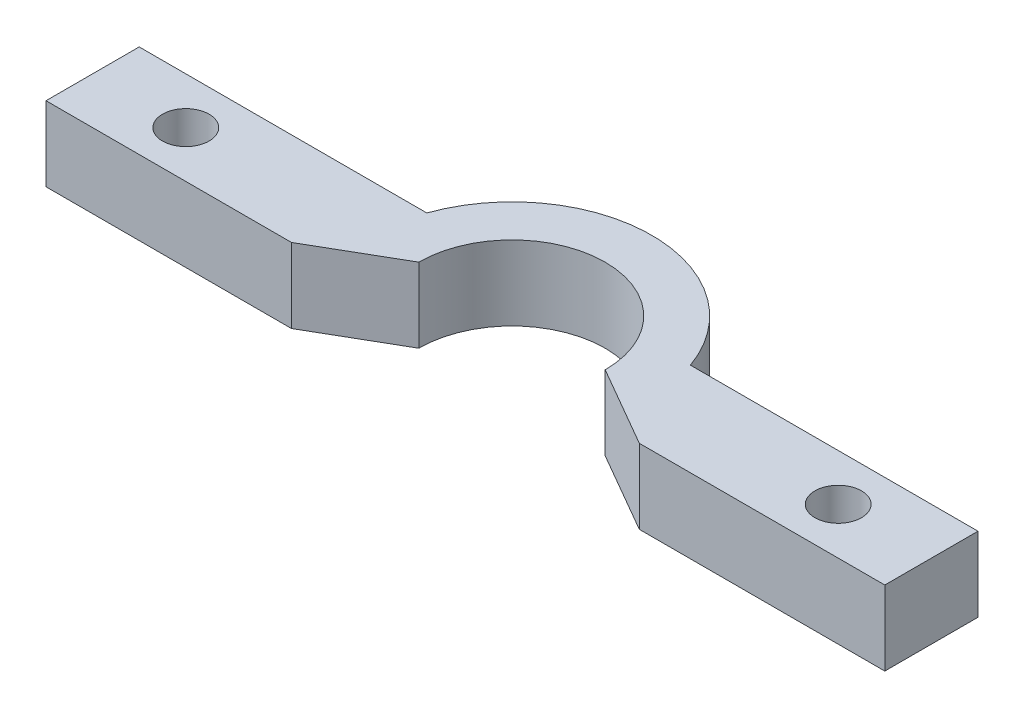
from build123d import *

# Parameters (mm, degrees)
SKETCH1_R           = 0.79375
BOSS_EXTRUDE1_DEPTH = 1.27


with BuildPart() as part:
    # Sketch1 → Boss-Extrude1 (new, symmetric)
    # profile 1 of 7: a face of its own
    with BuildSketch(Plane(origin=(0, 0, 0), x_dir=(1, 0, 0), z_dir=(0, 1, 0))):
        with BuildLine():
            ThreePointArc((-4.682314967, -0.870248702), (-4.742411374, -0.436967517), (-4.7625, 0))
            ThreePointArc((-4.7625, 0), (-4.69391314, 0.805348174), (-4.490128061, 1.5875))
            Line((-4.490128061, 1.5875), (-14.2875, 1.5875))
            Line((-14.2875, 1.5875), (-14.2875, -1.5875))
            Line((-14.2875, -1.5875), (-5.924630657, -1.5875))
            Line((-5.924630657, -1.5875), (-4.682314967, -0.870248702))
        make_face()
        with Locations(Location((-11.1125, 0, 0), (0, 0, 270))):
            Circle(SKETCH1_R, mode=Mode.SUBTRACT)
    # profile 2 of 7: a face of its own
    with BuildSketch(Plane(origin=(0, 0, 0), x_dir=(1, 0, 0), z_dir=(0, 1, 0))):
        with BuildLine():
            Line((-4.7625, 0), (-3.175, 0))
            ThreePointArc((-3.175, 0), (-3.066814498, 0.821750468), (-2.749630657, 1.5875))
            Line((-2.749630657, 1.5875), (-4.490128061, 1.5875))
            ThreePointArc((-4.490128061, 1.5875), (-4.69391314, 0.805348174), (-4.7625, 0))
        make_face()
    # profile 3 of 7: a face of its own
    with BuildSketch(Plane(origin=(0, 0, 0), x_dir=(1, 0, 0), z_dir=(0, 1, 0))):
        with BuildLine():
            ThreePointArc((-2.749630657, 1.5875), (0, 3.175), (2.749630657, 1.5875))
            Line((2.749630657, 1.5875), (4.490128061, 1.5875))
            ThreePointArc((4.490128061, 1.5875), (0, 4.7625), (-4.490128061, 1.5875))
            Line((-4.490128061, 1.5875), (-2.749630657, 1.5875))
        make_face()
    # profile 4 of 7: a face of its own
    with BuildSketch(Plane(origin=(0, 0, 0), x_dir=(1, 0, 0), z_dir=(0, 1, 0))):
        with BuildLine():
            ThreePointArc((2.749630657, 1.5875), (3.066814498, 0.821750468), (3.175, 0))
            Line((3.175, 0), (4.7625, 0))
            ThreePointArc((4.7625, 0), (4.69391314, 0.805348174), (4.490128061, 1.5875))
            Line((4.490128061, 1.5875), (2.749630657, 1.5875))
        make_face()
    # profile 5 of 7: a face of its own
    with BuildSketch(Plane(origin=(0, 0, 0), x_dir=(1, 0, 0), z_dir=(0, 1, 0))):
        with BuildLine():
            ThreePointArc((4.490128061, 1.5875), (4.69391314, 0.805348174), (4.7625, 0))
            ThreePointArc((4.7625, 0), (4.742411374, -0.436967517), (4.682314967, -0.870248702))
            Line((4.682314967, -0.870248702), (5.924630657, -1.5875))
            Line((5.924630657, -1.5875), (14.2875, -1.5875))
            Line((14.2875, -1.5875), (14.2875, 1.5875))
            Line((14.2875, 1.5875), (4.490128061, 1.5875))
        make_face()
        with Locations(Location((11.1125, 0, 0), (0, 0, 270))):
            Circle(SKETCH1_R, mode=Mode.SUBTRACT)
    # profile 6 of 7: a face of its own
    with BuildSketch(Plane(origin=(0, 0, 0), x_dir=(1, 0, 0), z_dir=(0, 1, 0))):
        with BuildLine():
            Line((-4.682314967, -0.870248702), (-3.175, 0))
            Line((-3.175, 0), (-4.7625, 0))
            ThreePointArc((-4.7625, 0), (-4.742411374, -0.436967517), (-4.682314967, -0.870248702))
        make_face()
    # profile 7 of 7: a face of its own
    with BuildSketch(Plane(origin=(0, 0, 0), x_dir=(1, 0, 0), z_dir=(0, 1, 0))):
        with BuildLine():
            Line((4.7625, 0), (3.175, 0))
            Line((3.175, 0), (4.682314967, -0.870248702))
            ThreePointArc((4.682314967, -0.870248702), (4.742411374, -0.436967517), (4.7625, 0))
        make_face()
    extrude(amount=BOSS_EXTRUDE1_DEPTH, both=True)


solid = part.part
